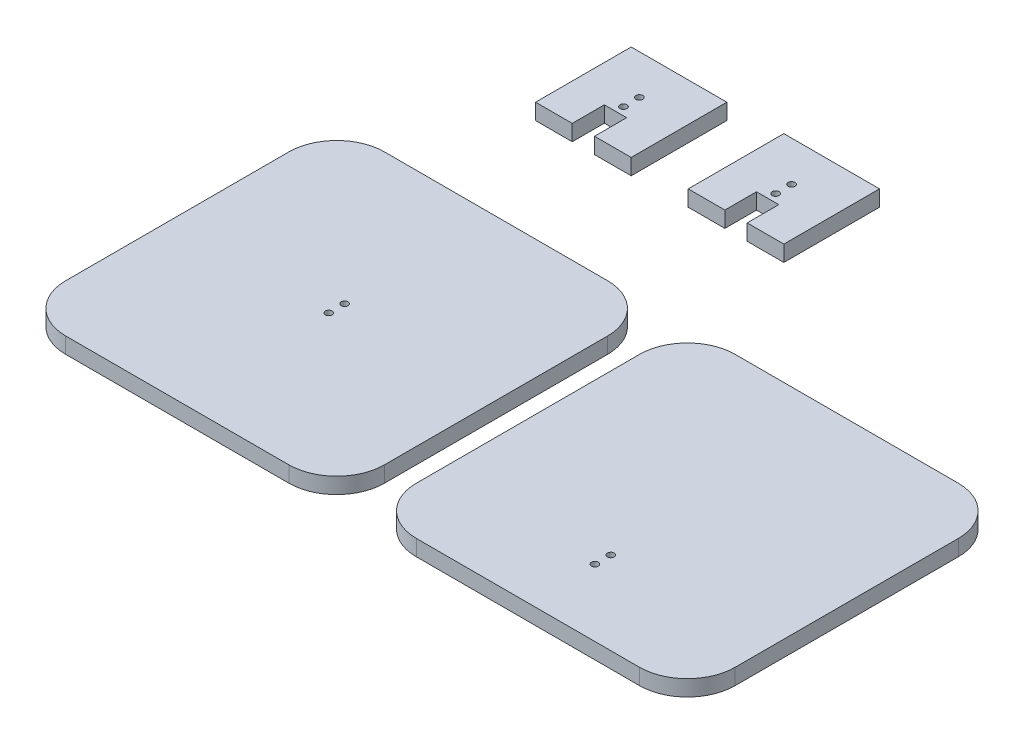
from build123d import *

# Parameters (mm, degrees)
SKETCH1_W             = 200
SKETCH1_H             = 200
BOSS_EXTRUDE1_DEPTH   = 10
BOSS_EXTRUDE1_2_DEPTH = 10
FILLET1_R             = 30
FILLET2_R             = 30
SKETCH2_R             = 2.15
CUT_EXTRUDE1_DEPTH    = 15
SKETCH3_R             = 2.15
CUT_EXTRUDE2_DEPTH    = 15
SKETCH4_R             = 2.15
BOSS_EXTRUDE2_DEPTH   = 10
BOSS_EXTRUDE2_2_DEPTH = 10


with BuildPart() as part:
    # Sketch1 → Boss-Extrude1 (new body)
    with BuildSketch(Plane(origin=(0, 0, 0), x_dir=(1, 0, 0), z_dir=(0, 1, 0))):
        with Locations((100, 100)):
            Rectangle(SKETCH1_W, SKETCH1_H)
    extrude(amount=BOSS_EXTRUDE1_DEPTH)

    # Fillet1
    fillet1_edges = [part.edges().sort_by_distance(p)[0] for p in [
        (0, 5, -200),
        (200, 5, -200),
        (200, 5, 0),
        (0, 5, 0),
    ]]
    fillet(fillet1_edges, radius=FILLET1_R)

    # Sketch2 → Cut-Extrude1 (cut)
    with BuildSketch(Plane(origin=(0, 10, 0), x_dir=(1, 0, 0), z_dir=(0, 1, 0))):
        with Locations(Location((100, 105, 0), (0, 0, 270))):
            Circle(SKETCH2_R)
        with Locations(Location((100, 95, 0), (0, 0, 270))):
            Circle(SKETCH2_R)
    extrude(amount=-CUT_EXTRUDE1_DEPTH, mode=Mode.SUBTRACT)


with BuildPart() as body_2:
    # Sketch1 → Boss-Extrude1 2 (new body)
    with BuildSketch(Plane(origin=(0, 0, 0), x_dir=(1, 0, 0), z_dir=(0, 1, 0))):
        with Locations((320, 100)):
            Rectangle(SKETCH1_W, SKETCH1_H)
    extrude(amount=BOSS_EXTRUDE1_2_DEPTH)

    # Fillet2
    fillet2_edges = [body_2.edges().sort_by_distance(p)[0] for p in [
        (220, 5, -200),
        (420, 5, -200),
        (420, 5, 0),
        (220, 5, 0),
    ]]
    fillet(fillet2_edges, radius=FILLET2_R)

    # Sketch3 → Cut-Extrude2 (cut)
    with BuildSketch(Plane(origin=(0, 10, 0), x_dir=(1, 0, 0), z_dir=(0, 1, 0))):
        with Locations(Location((320, 52, 0), (0, 0, 270))):
            Circle(SKETCH3_R)
        with Locations(Location((320, 42, 0), (0, 0, 270))):
            Circle(SKETCH3_R)
    extrude(amount=-CUT_EXTRUDE2_DEPTH, mode=Mode.SUBTRACT)


with BuildPart() as body_3:
    # Sketch4 → Boss-Extrude2 (new body)
    with BuildSketch(Plane(origin=(0, 0, 0), x_dir=(1, 0, 0), z_dir=(0, 1, 0))):
        Polygon((50.383027517, 334.395521825), (110.383027517, 334.395521825), (110.383027517, 274.395521825), (87.383027517, 274.395521825), (87.383027517, 294.550426589), (73.383027517, 294.550426589), (73.383027517, 274.395521825), (50.383027517, 274.395521825), align=None)
        with Locations(Location((80.383027517, 309.550560012, 0), (0, 0, 270))):
            Circle(SKETCH4_R, mode=Mode.SUBTRACT)
        with Locations(Location((80.383027517, 299.550426589, 0), (0, 0, 270))):
            Circle(SKETCH4_R, mode=Mode.SUBTRACT)
    extrude(amount=BOSS_EXTRUDE2_DEPTH)


with BuildPart() as body_4:
    # Sketch4 → Boss-Extrude2 2 (new body)
    with BuildSketch(Plane(origin=(0, 0, 0), x_dir=(1, 0, 0), z_dir=(0, 1, 0))):
        Polygon((145.347622786, 335.196024893), (205.347622786, 335.196024893), (205.347622786, 275.196024893), (182.347622786, 275.196024893), (182.347622786, 295.040986706), (168.347622786, 295.040986706), (168.347622786, 275.196024893), (145.347622786, 275.196024893), align=None)
        with Locations(Location((175.347622786, 310.041120128, 0), (0, 0, 270))):
            Circle(SKETCH4_R, mode=Mode.SUBTRACT)
        with Locations(Location((175.347622786, 300.040986706, 0), (0, 0, 270))):
            Circle(SKETCH4_R, mode=Mode.SUBTRACT)
    extrude(amount=BOSS_EXTRUDE2_2_DEPTH)


solid = Compound([part.part, body_2.part, body_3.part, body_4.part])
